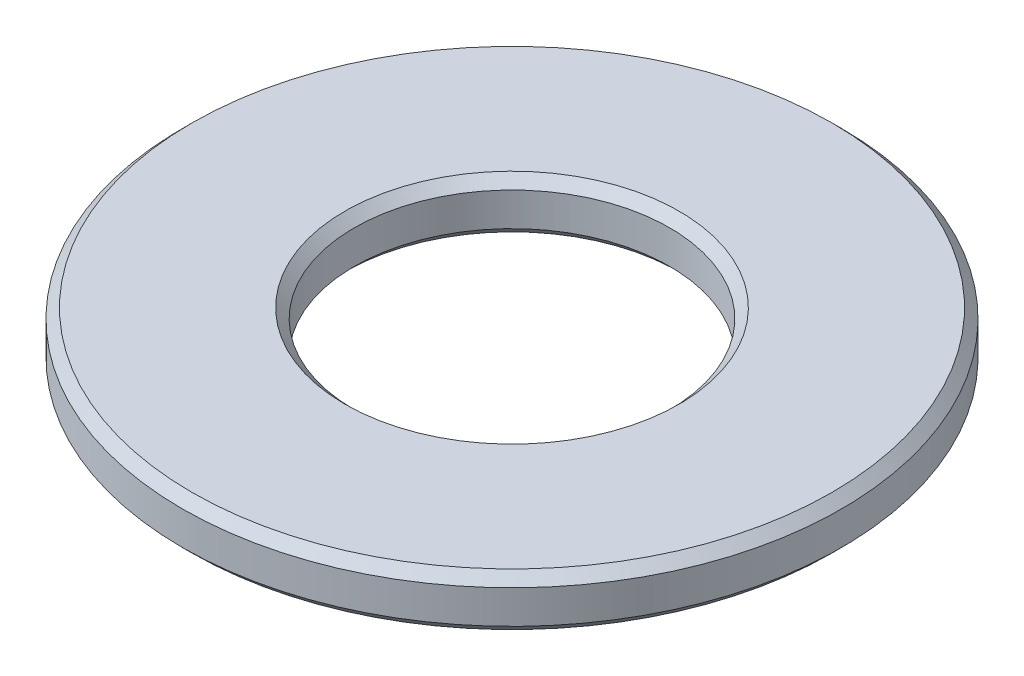
from build123d import *

# Parameters (mm, degrees)
SKIZZE1_R                       = 3.45
SKIZZE1_R_2                     = 1.65
AUFSATZ_LINEAR_AUSTRAGEN1_DEPTH = 0.55
FASE1_SIZE                      = 0.1


with BuildPart() as part:
    # Skizze1 → Aufsatz-Linear austragen1 (new body)
    with BuildSketch(Plane(origin=(0, 0, 0), x_dir=(1, 0, 0), z_dir=(0, 1, 0))):
        with Locations(Location((0, 0, 0), (0, 0, 270))):
            Circle(SKIZZE1_R)
        with Locations(Location((0, 0, 0), (0, 0, 270))):
            Circle(SKIZZE1_R_2, mode=Mode.SUBTRACT)
    extrude(amount=AUFSATZ_LINEAR_AUSTRAGEN1_DEPTH)

    # Fase1
    fase1_edges = [part.edges().sort_by_distance(p)[0] for p in [
        (0, 0, -3.45),
        (0, 0.55, -3.45),
        (0, 0, -1.65),
        (0, 0.55, -1.65),
    ]]
    chamfer(fase1_edges, length=FASE1_SIZE)


solid = part.part
